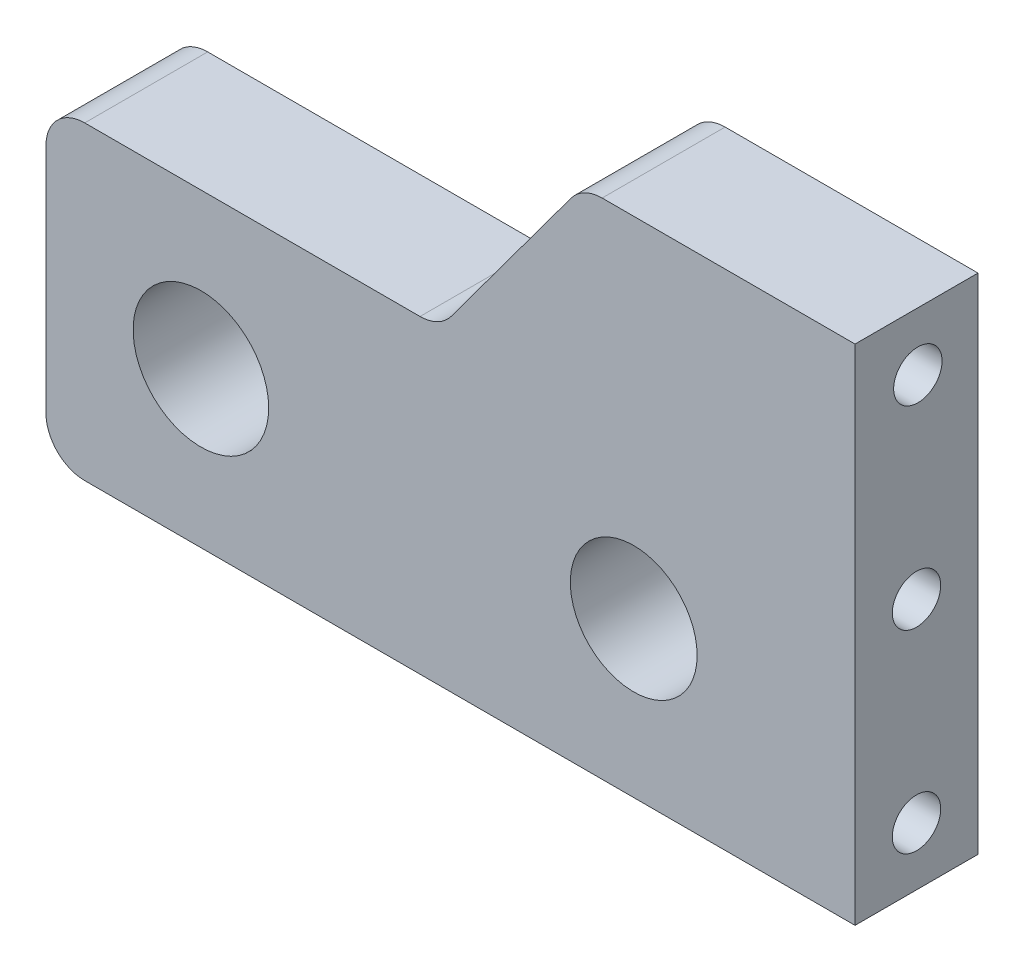
from build123d import *

# Parameters (mm, degrees)
SKETCH1_W           = 41.782
SKETCH1_H           = 16
BOSS_EXTRUDE1_DEPTH = 6.35
SKETCH1_6_R         = 3.275
SKETCH1_6_R_2       = 3.5
CUT_EXTRUDE1_DEPTH  = 6.35
FILLET1_R           = 2
SKETCH2_R           = 1.25
CUT_EXTRUDE2_DEPTH  = 4
BOSS_EXTRUDE2_DEPTH = 6.35
FILLET2_R           = 2
SKETCH4_R           = 1.25
CUT_EXTRUDE3_DEPTH  = 4


with BuildPart() as part:
    # Sketch1 → Boss-Extrude1 (new body)
    with BuildSketch(Plane.XY):
        with Locations((20.891, 8)):
            Rectangle(SKETCH1_W, SKETCH1_H)
    extrude(amount=BOSS_EXTRUDE1_DEPTH)

    # Sketch1<6> → Cut-Extrude1 (cut)
    with BuildSketch(Plane.XY):
        with Locations((30.352, 8)):
            Circle(SKETCH1_6_R)
        with Locations((8, 8)):
            Circle(SKETCH1_6_R_2)
    extrude(amount=CUT_EXTRUDE1_DEPTH, mode=Mode.SUBTRACT)

    # Fillet1
    fillet1_edges = [part.edges().sort_by_distance(p)[0] for p in [
        (0, 16, 3.175),
        (0, 0, 3.175),
    ]]
    fillet(fillet1_edges, radius=FILLET1_R)

    # Sketch2 → Cut-Extrude2 (cut)
    with BuildSketch(Plane(origin=(41.782, 0, 0), x_dir=(0, 0, -1), z_dir=(1, 0, 0))):
        with Locations((-3.175, 13)):
            Circle(SKETCH2_R)
        with Locations((-3.175, 3)):
            Circle(SKETCH2_R)
    extrude(amount=-CUT_EXTRUDE2_DEPTH, mode=Mode.SUBTRACT)

    # Sketch3 → Boss-Extrude2 (add)
    with BuildSketch(Plane.XY.offset(6.35)):
        Polygon((20.326281713, 16), (41.782, 16), (41.782, 26), (27.712043107, 26), align=None)
    extrude(amount=-BOSS_EXTRUDE2_DEPTH)

    # Fillet2
    fillet2_edges = [part.edges().sort_by_distance(p)[0] for p in [
        (20.326281713, 16, 3.175),
        (27.712043107, 26, 3.175),
    ]]
    fillet(fillet2_edges, radius=FILLET2_R)

    # Sketch4 → Cut-Extrude3 (cut)
    with BuildSketch(Plane(origin=(41.782, 0, 0), x_dir=(0, 0, -1), z_dir=(1, 0, 0))):
        with Locations((-3.10572404, 23)):
            Circle(SKETCH4_R)
    extrude(amount=-CUT_EXTRUDE3_DEPTH, mode=Mode.SUBTRACT)


solid = part.part
